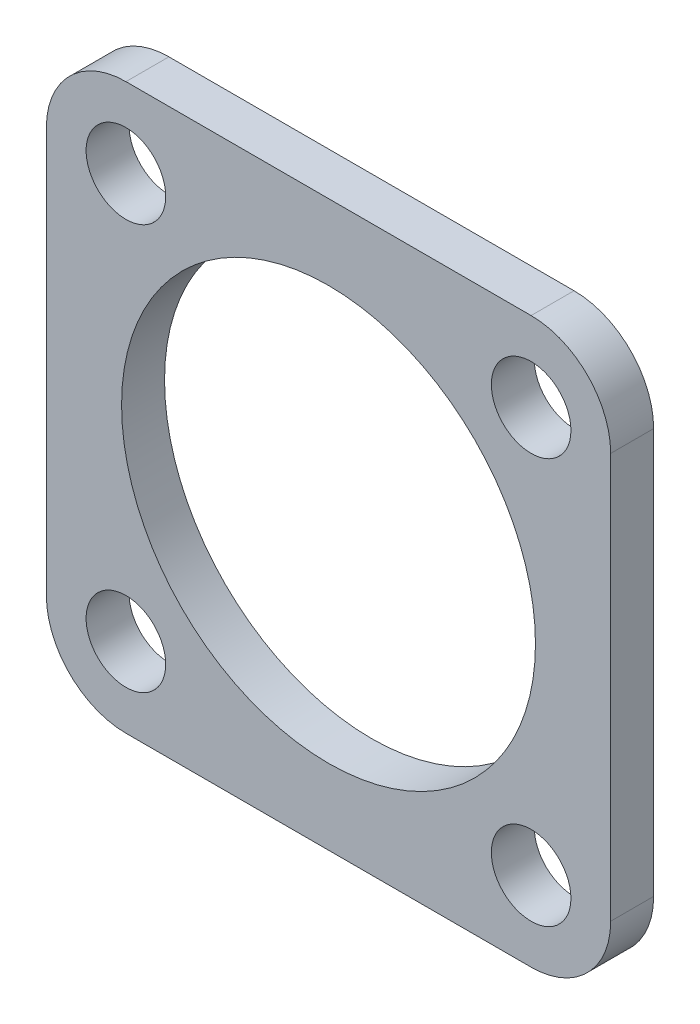
from build123d import *

# Parameters (mm, degrees)
BOSS_EXTRUDE1_DEPTH      = 5
BOSS_EXTRUDE1_DEPTH_BACK = 0.397201273
SKETCH1_W                = 70.9
SKETCH1_H                = 70.9
SKETCH1_R                = 5
SKETCH1_R_2              = 26
FILLET1_R                = 10


with BuildPart() as part:
    # Sketch1 → Boss-Extrude1 (new, two sides: drawn at the far end of the back side and taken through both)
    with BuildSketch(Plane.XY.offset(-BOSS_EXTRUDE1_DEPTH_BACK)):
        with Locations((35.45, 35.45)):
            Rectangle(SKETCH1_W, SKETCH1_H)
        with Locations((9.995, 60.905)):
            Circle(SKETCH1_R, mode=Mode.SUBTRACT)
        with Locations((60.905, 60.905)):
            Circle(SKETCH1_R, mode=Mode.SUBTRACT)
        with Locations((60.905, 9.995)):
            Circle(SKETCH1_R, mode=Mode.SUBTRACT)
        with Locations((9.995, 9.995)):
            Circle(SKETCH1_R, mode=Mode.SUBTRACT)
        with Locations((35.45, 35.45)):
            Circle(SKETCH1_R_2, mode=Mode.SUBTRACT)
    extrude(amount=BOSS_EXTRUDE1_DEPTH + BOSS_EXTRUDE1_DEPTH_BACK)

    # Fillet1
    fillet1_edges = [part.edges().sort_by_distance(p)[0] for p in [
        (0, 70.9, 2.301399364),
        (70.9, 70.9, 2.301399364),
        (70.9, 0, 2.301399364),
        (0, 0, 2.301399364),
    ]]
    fillet(fillet1_edges, radius=FILLET1_R)


solid = part.part
